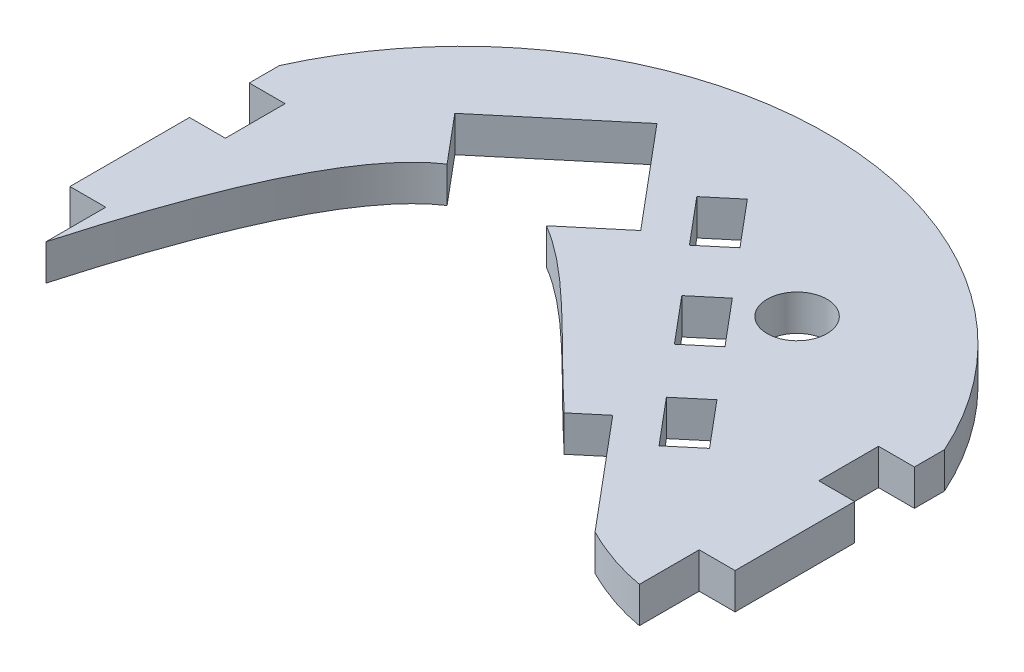
from build123d import *

# Parameters (mm, degrees)
CROQUIS1_R                 = 30.5
SALIENTE_EXTRUIR1_DEPTH    = 3
CROQUIS2_R                 = 2
CORTAR_EXTRUIR1_DEPTH      = 4
CORTAR_EXTRUIR3_START      = -4
CORTAR_EXTRUIR3_DEPTH      = 4
CORTAR_EXTRUIR5_START      = -4
CORTAR_EXTRUIR5_DEPTH      = 4
CORTAR_EXTRUIR6_DEPTH      = 10
CROQUIS10_R                = 2.5
CORTAR_EXTRUIR7_DEPTH      = 3
CORTAR_EXTRUIR8_DEPTH      = 44.237715166
CORTAR_EXTRUIR8_DEPTH_BACK = 44.237715166


with BuildPart() as part:
    # Croquis1 → Saliente-Extruir1 (new body)
    with BuildSketch(Plane(origin=(0, 0, 0), x_dir=(1, 0, 0), z_dir=(0, 1, 0))):
        with Locations(Location((0, 0, 0), (0, 0, 270))):
            Circle(CROQUIS1_R)
    extrude(amount=SALIENTE_EXTRUIR1_DEPTH)

    # Croquis2 → Cortar-Extruir1 (cut)
    with BuildSketch(Plane(origin=(0, 3, 0), x_dir=(1, 0, 0), z_dir=(0, 1, 0))):
        with Locations(Location((0, 0, 0), (0, 0, 270))):
            Circle(CROQUIS2_R)
    extrude(amount=-CORTAR_EXTRUIR1_DEPTH, mode=Mode.SUBTRACT)

    # Croquis5 → Cortar-Extruir3 (cut)
    with BuildSketch(Plane(origin=(0, 3, 0), x_dir=(1, 0, 0), z_dir=(0, 1, 0)).offset(CORTAR_EXTRUIR3_START)):
        with BuildLine():
            Line((28.814059068, 5), (30.087372767, 5))
            ThreePointArc((30.087372767, 5), (29.556634924, 7.526973624), (28.814059068, 10))
            Line((28.814059068, 10), (24.814059068, 10))
            Line((24.814059068, 10), (24.814059068, 5))
            Line((24.814059068, 5), (28.814059068, 5))
        make_face()
        with BuildLine():
            Line((30.087372767, -5), (28.814059068, -5))
            Line((28.814059068, -5), (24.814059068, -5))
            Line((24.814059068, -5), (24.814059068, -10))
            Line((24.814059068, -10), (28.814059068, -10))
            ThreePointArc((28.814059068, -10), (29.556634924, -7.526973624), (30.087372767, -5))
        make_face()
        with BuildLine():
            Line((-24.814059068, 5), (-24.814059068, 10))
            Line((-24.814059068, 10), (-28.814059068, 10))
            ThreePointArc((-28.814059068, 10), (-29.556634924, 7.526973624), (-30.087372767, 5))
            Line((-30.087372767, 5), (-28.814059068, 5))
            Line((-28.814059068, 5), (-24.814059068, 5))
        make_face()
        with BuildLine():
            Line((-28.814059068, -10), (-24.814059068, -10))
            Line((-24.814059068, -10), (-24.814059068, -5))
            Line((-24.814059068, -5), (-28.814059068, -5))
            Line((-28.814059068, -5), (-30.087372767, -5))
            ThreePointArc((-30.087372767, -5), (-29.556634924, -7.526973624), (-28.814059068, -10))
        make_face()
    extrude(amount=CORTAR_EXTRUIR3_DEPTH, mode=Mode.SUBTRACT)

    # Croquis7 → Cortar-Extruir5 (cut)
    with BuildSketch(Plane(origin=(0, 3, 0), x_dir=(1, 0, 0), z_dir=(0, 1, 0)).offset(CORTAR_EXTRUIR5_START)):
        Polygon((1.428390211, 22.411430151), (-0.869743118, 20.483067322), (2.34419493, 16.652845106), (4.642328259, 18.581207935), align=None)
        with BuildLine():
            Line((-24.814059068, -10), (-28.814059068, -10))
            ThreePointArc((-28.814059068, -10), (0, -30.5), (28.814059068, -10))
            Line((28.814059068, -10), (24.814059068, -10))
            add(Edge.make_bspline(
                [(24.814059068, -10), (22.863263717, -9.657344338), (20.984021298, -8.980450277), (19.168992989, -8.065339906)],
                knots=[0, 0, 0, 0, 0.087850084, 0.087850084, 0.087850084, 0.087850084], degree=3))
            Line((19.168992989, -8.065339906), (11.455541673, 1.127193412))
            Line((11.455541673, 1.127193412), (9.248678515, -0.72458465))
            add(Edge.make_bspline(
                [(9.248678515, -0.72458465), (4.033234859, 4.116641048), (-0.646914404, 9.508508747), (-5.04935939, 12.080675515)],
                knots=[0.258799312, 0.258799312, 0.258799312, 0.258799312, 0.546435258, 0.546435258, 0.546435258, 0.546435258], degree=3))
            Line((-5.04935939, 12.080675515), (-0.757422911, 15.682037831))
            Line((-0.757422911, 15.682037831), (-7.828086618, 24.108526705))
            Line((-7.828086618, 24.108526705), (-17.020619935, 16.395075389))
            Line((-17.020619935, 16.395075389), (-13.66601447, 12.397212273))
            add(Edge.make_bspline(
                [(-13.66601447, 12.397212273), (-17.403465693, 9.897923685), (-21.056529869, 3.255841362), (-24.814059068, -10)],
                knots=[0.740637404, 0.740637404, 0.740637404, 0.740637404, 1, 1, 1, 1], degree=3))
        make_face()
        Polygon((14.685884661, 6.611763511), (12.387751331, 4.683400682), (15.60168938, 0.853178467), (17.899822709, 2.781541296), align=None)
    extrude(amount=CORTAR_EXTRUIR5_DEPTH, mode=Mode.SUBTRACT)

    # Croquis9 → Cortar-Extruir6 (cut)
    with BuildSketch(Plane(origin=(0, 3, 0), x_dir=(1, 0, 0), z_dir=(0, 1, 0))):
        Polygon((7.971418181, 14.613753061), (5.673284852, 12.685390231), (8.887222901, 8.855168016), (11.18535623, 10.783530845), align=None)
    extrude(amount=-CORTAR_EXTRUIR6_DEPTH, mode=Mode.SUBTRACT)

    # Croquis10 → Cortar-Extruir7 (cut)
    with BuildSketch(Plane(origin=(0, 3, 0), x_dir=(1, 0, 0), z_dir=(0, 1, 0))):
        with Locations(Location((12, 16, 0), (0, 0, 270))):
            Circle(CROQUIS10_R)
    extrude(amount=-CORTAR_EXTRUIR7_DEPTH, mode=Mode.SUBTRACT)

    # Croquis11 → Cortar-Extruir8 (cut, two sides: drawn at the far end of the back side and taken through both)
    with BuildSketch(Plane(origin=(0, 3, 0), x_dir=(1, 0, 0), z_dir=(0, 1, 0)).offset(-CORTAR_EXTRUIR8_DEPTH_BACK)):
        with BuildLine():
            Line((30.087372767, 5), (27.814059068, 5))
            Line((27.814059068, 5), (27.814059068, -5))
            Line((27.814059068, -5), (30.087372767, -5))
            ThreePointArc((30.087372767, -5), (30.5, 0), (30.087372767, 5))
        make_face()
        with BuildLine():
            ThreePointArc((28.814059068, 10), (28.341972277, 11.268655974), (27.814059068, 12.515115586))
            Line((27.814059068, 12.515115586), (27.814059068, 10))
            Line((27.814059068, 10), (28.814059068, 10))
        make_face()
        with BuildLine():
            Line((-27.814059068, -5), (-27.814059068, 5))
            Line((-27.814059068, 5), (-30.087372767, 5))
            ThreePointArc((-30.087372767, 5), (-30.5, 0), (-30.087372767, -5))
            Line((-30.087372767, -5), (-27.814059068, -5))
        make_face()
        with BuildLine():
            Line((-28.814059068, 10), (-27.814059068, 10))
            Line((-27.814059068, 10), (-27.814059068, 12.515115586))
            ThreePointArc((-27.814059068, 12.515115586), (-28.341972277, 11.268655974), (-28.814059068, 10))
        make_face()
    extrude(amount=CORTAR_EXTRUIR8_DEPTH + CORTAR_EXTRUIR8_DEPTH_BACK, mode=Mode.SUBTRACT)


solid = part.part
